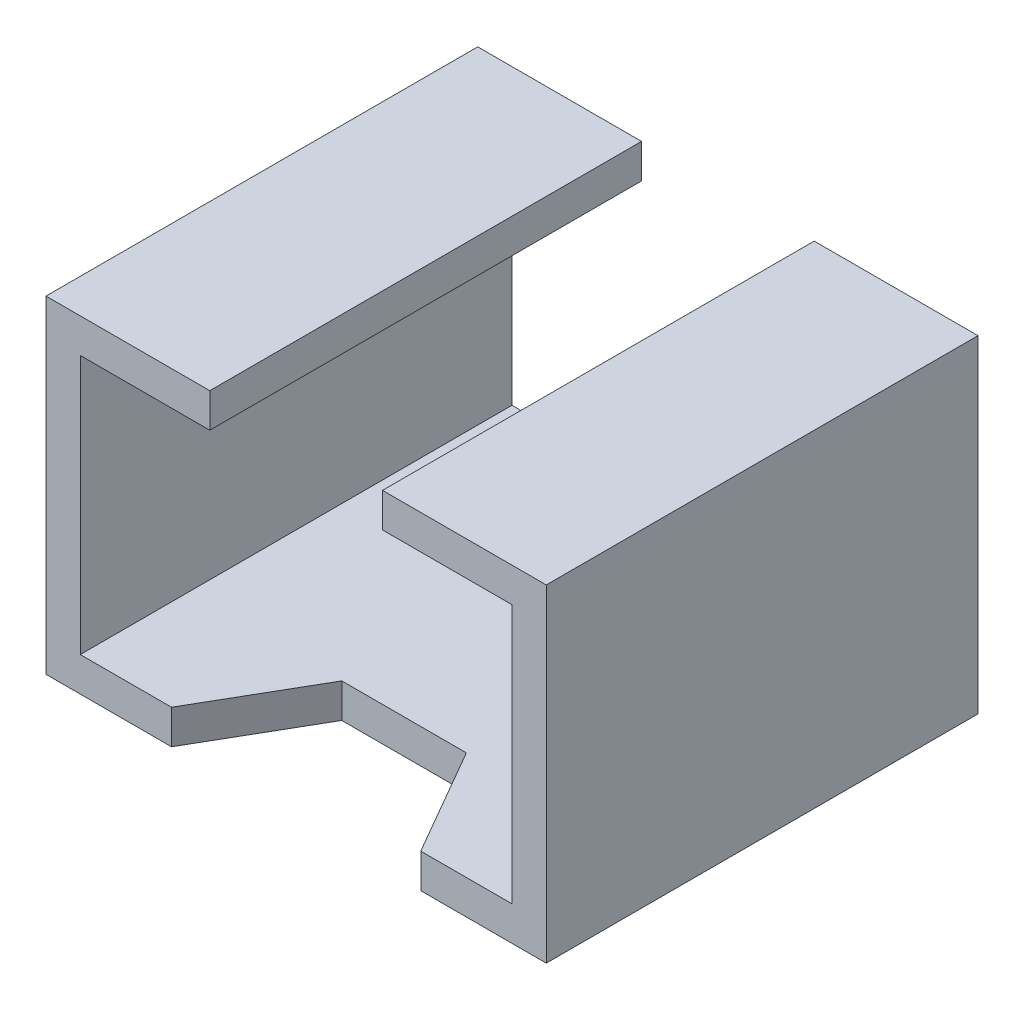
from build123d import *

# Parameters (mm, degrees)
SALIENTE_EXTRUIR1_DEPTH = 50
CORTAR_EXTRUIR1_DEPTH   = 10


with BuildPart() as part:
    # Croquis1 → Saliente-Extruir1 (new, symmetric)
    with BuildSketch(Plane.XY):
        Polygon((-50, 0), (50, 0), (50, 60), (20, 60), (20, 67.9375), (57.9375, 67.9375), (57.9375, -7.9375), (-57.9375, -7.9375), (-57.9375, 67.9375), (-20, 67.9375), (-20, 60), (-50, 60), align=None)
    extrude(amount=SALIENTE_EXTRUIR1_DEPTH, both=True)

    # Croquis2 → Cortar-Extruir1 (cut)
    with BuildSketch(Plane.XZ.offset(7.9375)):
        Polygon((-28.867513459, -50), (28.867513459, -50), (14.43375673, -25), (-14.43375673, -25), align=None)
        Polygon((-28.867513459, 50), (28.867513459, 50), (14.43375673, 25), (-14.43375673, 25), align=None)
    extrude(amount=-CORTAR_EXTRUIR1_DEPTH, mode=Mode.SUBTRACT)


solid = part.part
